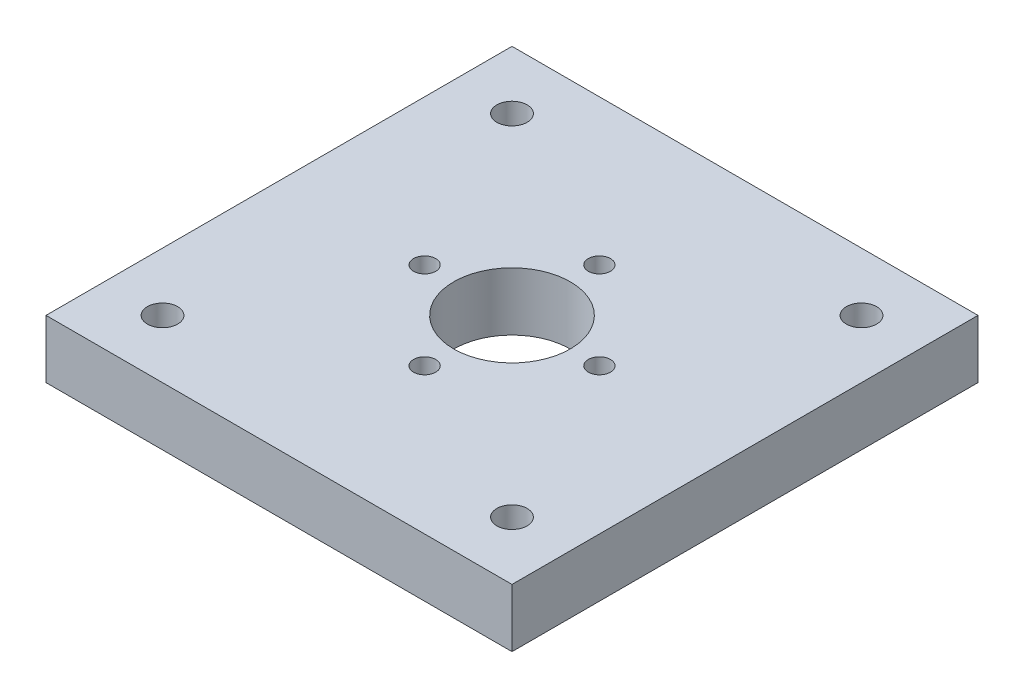
from build123d import *

# Parameters (mm, degrees)
SKETCH1_W           = 4
SKETCH1_H           = 4
SKETCH1_R           = 0.13
SKETCH1_R_2         = 0.095
SKETCH1_R_3         = 0.5
BOSS_EXTRUDE1_DEPTH = 0.5


with BuildPart() as part:
    # Sketch1 → Boss-Extrude1 (new body)
    with BuildSketch(Plane(origin=(0, 0, 0), x_dir=(1, 0, 0), z_dir=(0, 1, 0))):
        Rectangle(SKETCH1_W, SKETCH1_H)
        with Locations(Location((-1.5, 1.5, 0), (0, 0, 270))):
            Circle(SKETCH1_R, mode=Mode.SUBTRACT)
        with Locations(Location((-1.5, -1.5, 0), (0, 0, 270))):
            Circle(SKETCH1_R, mode=Mode.SUBTRACT)
        with Locations(Location((0, 0.75, 0), (0, 0, 270))):
            Circle(SKETCH1_R_2, mode=Mode.SUBTRACT)
        with Locations(Location((0, 0, 0), (0, 0, 270))):
            Circle(SKETCH1_R_3, mode=Mode.SUBTRACT)
        with Locations(Location((1.5, -1.5, 0), (0, 0, 90))):
            Circle(SKETCH1_R, mode=Mode.SUBTRACT)
        with Locations(Location((1.5, 1.5, 0), (0, 0, 90))):
            Circle(SKETCH1_R, mode=Mode.SUBTRACT)
        with Locations(Location((0.75, 0, 0), (0, 0, 270))):
            Circle(SKETCH1_R_2, mode=Mode.SUBTRACT)
        with Locations(Location((0, -0.75, 0), (0, 0, 270))):
            Circle(SKETCH1_R_2, mode=Mode.SUBTRACT)
        with Locations(Location((-0.75, 0, 0), (0, 0, 270))):
            Circle(SKETCH1_R_2, mode=Mode.SUBTRACT)
    extrude(amount=BOSS_EXTRUDE1_DEPTH)


solid = part.part
